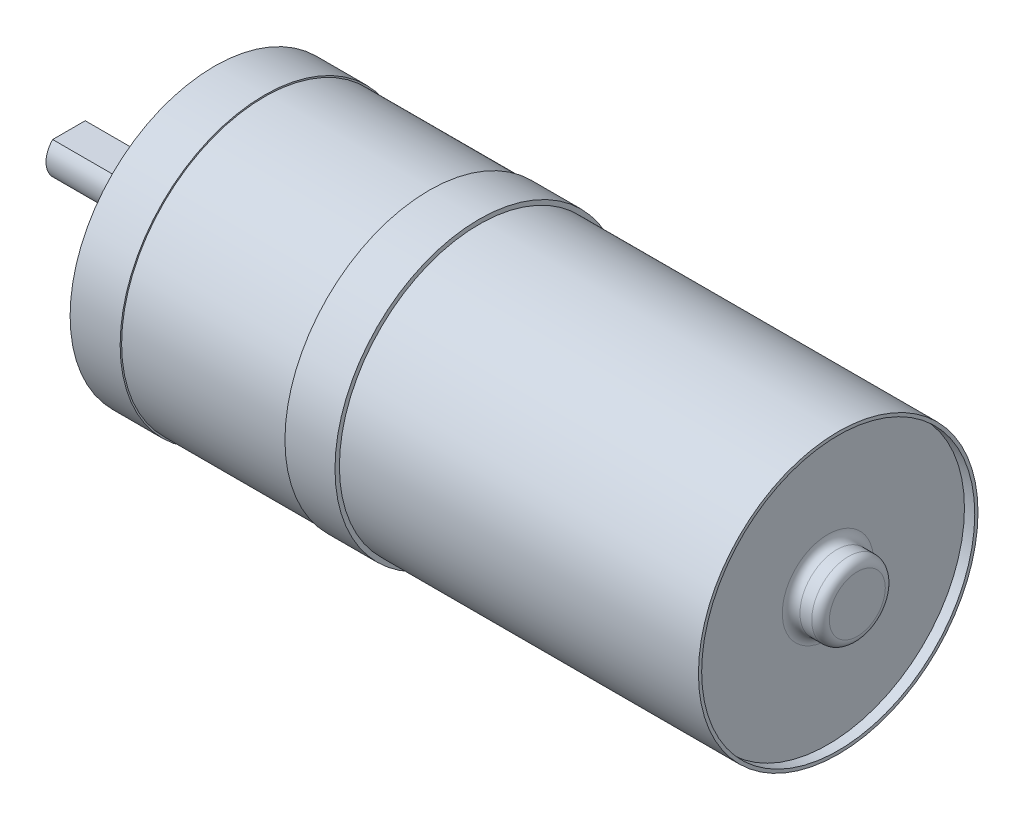
from build123d import *

# Parameters (mm, degrees)
SKETCH1_R           = 12.065
BOSS_EXTRUDE1_DEPTH = 30.988
SKETCH2_R           = 12.446
BOSS_EXTRUDE2_DEPTH = 4.318
SKETCH3_R           = 12.319
BOSS_EXTRUDE3_DEPTH = 14.224
SKETCH4_R           = 12.446
BOSS_EXTRUDE4_DEPTH = 4.318
SKETCH5_R           = 3.5052
BOSS_EXTRUDE5_DEPTH = 2.54
SKETCH6_R           = 1.9812
BOSS_EXTRUDE6_DEPTH = 10.0076
CUT_EXTRUDE1_START  = -7.9248
CUT_EXTRUDE1_DEPTH  = 7.9248
SKETCH8_R           = 11.7856
CUT_EXTRUDE2_DEPTH  = 0.889
SKETCH9_R           = 3.175
BOSS_EXTRUDE7_DEPTH = 2.54
FILLET1_R           = 0.762
SKETCH10_R          = 1.397
CUT_EXTRUDE3_DEPTH  = 4.7498


with BuildPart() as part:
    # Sketch1 → Boss-Extrude1 (new body)
    with BuildSketch(Plane(origin=(0, 0, 0), x_dir=(0, 0, -1), z_dir=(1, 0, 0))):
        Circle(SKETCH1_R)
    extrude(amount=BOSS_EXTRUDE1_DEPTH)

    # Sketch2 → Boss-Extrude2 (add)
    with BuildSketch(Plane.ZY):
        Circle(SKETCH2_R)
    extrude(amount=BOSS_EXTRUDE2_DEPTH)

    # Sketch3 → Boss-Extrude3 (add)
    with BuildSketch(Plane.ZY.offset(4.318)):
        Circle(SKETCH3_R)
    extrude(amount=BOSS_EXTRUDE3_DEPTH)

    # Sketch4 → Boss-Extrude4 (add)
    with BuildSketch(Plane.ZY.offset(18.542)):
        Circle(SKETCH4_R)
    extrude(amount=BOSS_EXTRUDE4_DEPTH)

    # Sketch5 → Boss-Extrude5 (add)
    with BuildSketch(Plane.ZY.offset(22.86)):
        Circle(SKETCH5_R)
    extrude(amount=BOSS_EXTRUDE5_DEPTH)

    # Sketch6 → Boss-Extrude6 (add)
    with BuildSketch(Plane.ZY.offset(25.4)):
        Circle(SKETCH6_R)
    extrude(amount=BOSS_EXTRUDE6_DEPTH)

    # Sketch7 → Cut-Extrude1 (cut)
    with BuildSketch(Plane.ZY.offset(35.4076).offset(CUT_EXTRUDE1_START)):
        with BuildLine():
            Line((-1.404828972, 1.397), (1.404828972, 1.397))
            ThreePointArc((1.404828972, 1.397), (0, 1.9812), (-1.404828972, 1.397))
        make_face()
    extrude(amount=CUT_EXTRUDE1_DEPTH, mode=Mode.SUBTRACT)

    # Sketch8 → Cut-Extrude2 (cut)
    with BuildSketch(Plane(origin=(30.988, 0, 0), x_dir=(0, 0, -1), z_dir=(1, 0, 0))):
        Circle(SKETCH8_R)
    extrude(amount=-CUT_EXTRUDE2_DEPTH, mode=Mode.SUBTRACT)

    # Sketch9 → Boss-Extrude7 (add)
    with BuildSketch(Plane(origin=(30.099, 0, 0), x_dir=(0, 0, -1), z_dir=(1, 0, 0))):
        Circle(SKETCH9_R)
    extrude(amount=BOSS_EXTRUDE7_DEPTH)

    # Fillet1
    fillet1_edges = [part.edges().sort_by_distance(p)[0] for p in [
        (30.099, 0, 3.175),
        (32.639, 0, 3.175),
    ]]
    fillet(fillet1_edges, radius=FILLET1_R)

    # Sketch10 → Cut-Extrude3 (cut)
    with BuildSketch(Plane.ZY.offset(22.86)):
        with Locations((8.509, 0)):
            Circle(SKETCH10_R)
        with Locations((-8.509, 0)):
            Circle(SKETCH10_R)
    extrude(amount=-CUT_EXTRUDE3_DEPTH, mode=Mode.SUBTRACT)


solid = part.part
